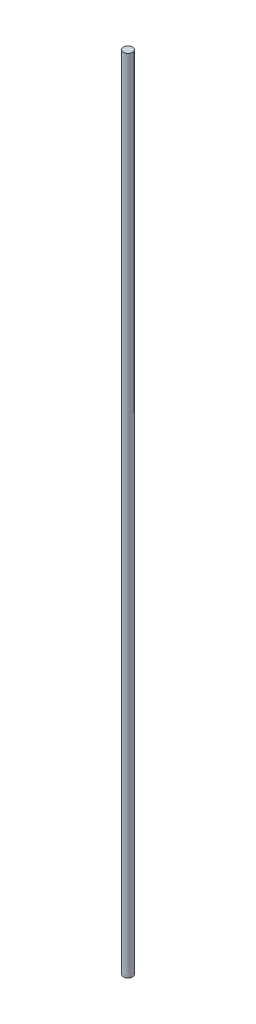
from build123d import *

# Parameters (mm, degrees)
SKETCH2_R           = 1.5
BOSS_EXTRUDE1_DEPTH = 265


with BuildPart() as part:
    # Sketch2 → Boss-Extrude1 (new body)
    with BuildSketch(Plane(origin=(0, 0, 0), x_dir=(1, 0, 0), z_dir=(0, 1, 0))):
        with Locations(Location((0, 0, 0), (0, 0, 270))):
            Circle(SKETCH2_R)
    extrude(amount=BOSS_EXTRUDE1_DEPTH)


solid = part.part
